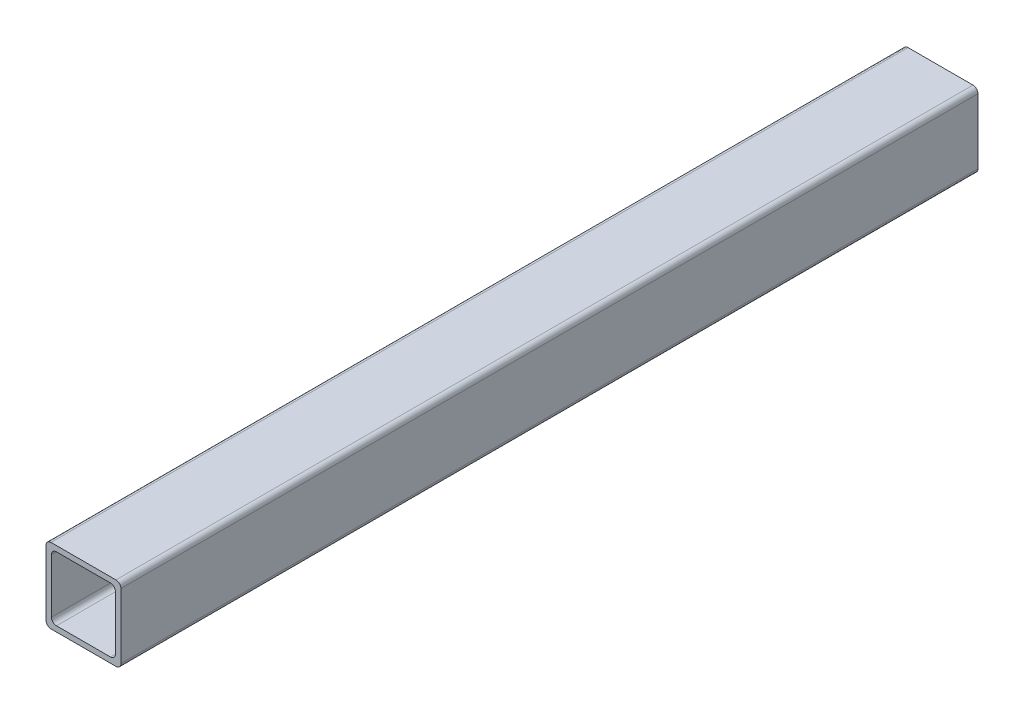
from build123d import *

# Parameters (mm, degrees)
BOSS_EXTRUDE1_DEPTH = 435.78


with BuildPart() as part:
    # Sketch1 → Boss-Extrude1 (new body)
    with BuildSketch(Plane.XY):
        with BuildLine():
            Line((2.54, 0), (35.56, 0))
            ThreePointArc((35.56, 0), (37.356051224, -0.743948776), (38.1, -2.54))
            Line((38.1, -2.54), (38.1, -35.56))
            ThreePointArc((38.1, -35.56), (37.356051224, -37.356051224), (35.56, -38.1))
            Line((35.56, -38.1), (2.54, -38.1))
            ThreePointArc((2.54, -38.1), (0.743948776, -37.356051224), (0, -35.56))
            Line((0, -35.56), (0, -2.54))
            ThreePointArc((0, -2.54), (0.743948776, -0.743948776), (2.54, 0))
        make_face()
        with BuildLine():
            Line((5.3086, -2.7686), (32.7914, -2.7686))
            ThreePointArc((32.7914, -2.7686), (34.587451224, -3.512548776), (35.3314, -5.3086))
            Line((35.3314, -5.3086), (35.3314, -32.7914))
            ThreePointArc((35.3314, -32.7914), (34.587451224, -34.587451224), (32.7914, -35.3314))
            Line((32.7914, -35.3314), (5.3086, -35.3314))
            ThreePointArc((5.3086, -35.3314), (3.512548776, -34.587451224), (2.7686, -32.7914))
            Line((2.7686, -32.7914), (2.7686, -5.3086))
            ThreePointArc((2.7686, -5.3086), (3.512548776, -3.512548776), (5.3086, -2.7686))
        make_face(mode=Mode.SUBTRACT)
    extrude(amount=BOSS_EXTRUDE1_DEPTH)


solid = part.part
